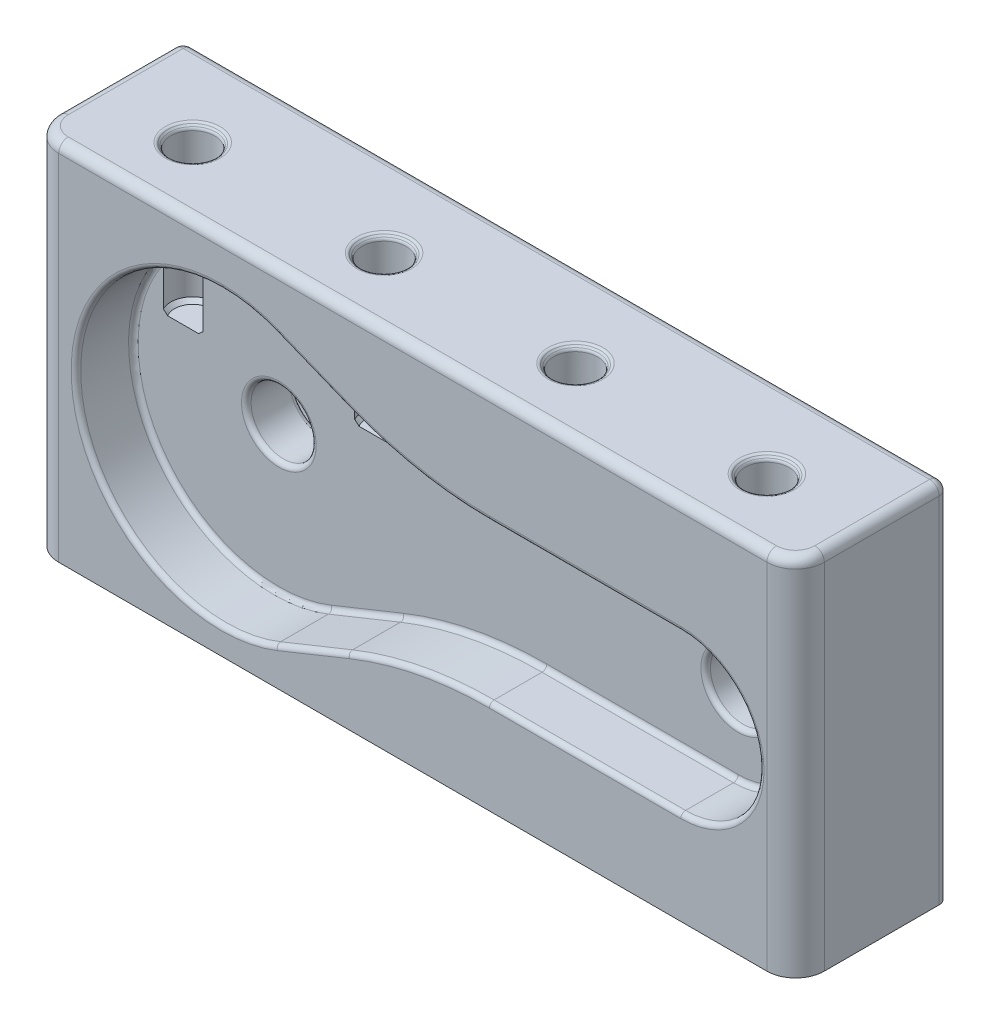
from build123d import *

# Parameters (mm, degrees)
SKETCH2_W           = 40
SKETCH2_H           = 19
BOSS_EXTRUDE1_DEPTH = 8
FILLET1_R           = 1.5
SKETCH5_R           = 1.15
CUT_EXTRUDE3_DEPTH  = 8
CHAMFER1_SIZE       = 0.2
FILLET3_R           = 0.2
FILLET2_R           = 0.5
SKETCH6_R           = 1.7
CUT_EXTRUDE4_DEPTH  = 24.542514734
SKETCH7_R           = 3
CUT_EXTRUDE5_DEPTH  = 2.5
CUT_EXTRUDE6_DEPTH  = 3
FILLET5_R           = 0.25
FILLET6_R           = 0.25


with BuildPart() as part:
    # Sketch2 → Boss-Extrude1 (new body)
    with BuildSketch(Plane.XY):
        Rectangle(SKETCH2_W, SKETCH2_H)
    extrude(amount=BOSS_EXTRUDE1_DEPTH)

    # Fillet1
    fillet1_edges = [part.edges().sort_by_distance(p)[0] for p in [
        (-20, 0, 8),
        (20, 0, 8),
    ]]
    fillet(fillet1_edges, radius=FILLET1_R)

    # Sketch5 → Cut-Extrude3 (cut)
    with BuildSketch(Plane(origin=(0, 9.5, 0), x_dir=(1, 0, 0), z_dir=(0, 1, 0))):
        with Locations(Location((-15, -4.5, 0), (0, 0, 270))):
            Circle(SKETCH5_R)
        with Locations(Location((-5, -4.5, 0), (0, 0, 270))):
            Circle(SKETCH5_R)
        with Locations(Location((5, -4.5, 0), (0, 0, 270))):
            Circle(SKETCH5_R)
        with Locations(Location((15, -4.5, 0), (0, 0, 270))):
            Circle(SKETCH5_R)
    extrude(amount=-CUT_EXTRUDE3_DEPTH, mode=Mode.SUBTRACT)

    # Chamfer1
    chamfer1_edges = [part.edges().sort_by_distance(p)[0] for p in [
        (-15, 1.5, 3.35),
        (-15, 9.5, 3.35),
        (-5, 1.5, 3.35),
        (-5, 9.5, 3.35),
        (5, 1.5, 3.35),
        (5, 9.5, 3.35),
        (15, 1.5, 3.35),
        (15, 9.5, 3.35),
    ]]
    chamfer(chamfer1_edges, length=CHAMFER1_SIZE)

    # Fillet3
    fillet3_edges = [part.edges().sort_by_distance(p)[0] for p in [
        (15, 9.3, 3.35),
        (-15, 9.5, 3.15),
        (-5, 9.5, 3.15),
        (5, 9.5, 3.15),
        (15, 9.5, 3.15),
        (5, 9.3, 3.35),
        (-5, 9.3, 3.35),
        (-15, 9.3, 3.35),
    ]]
    fillet(fillet3_edges, radius=FILLET3_R)

    # Fillet2
    fillet2_edges = [part.edges().sort_by_distance(p)[0] for p in [
        (0, 9.5, 8),
        (-20, 9.5, 3.25),
        (20, 9.5, 3.25),
        (-19.560660172, 9.5, 7.560660172),
        (19.560660172, 9.5, 7.560660172),
        (-20, 0, 0),
        (0, 9.5, 0),
        (20, 0, 0),
    ]]
    fillet(fillet2_edges, radius=FILLET2_R)

    # Sketch6 → Cut-Extrude4 (cut, through all)
    with BuildSketch(Plane.XY.offset(8)):
        with Locations((-10, -0.5)):
            Circle(SKETCH6_R)
        with Locations((14, -0.5)):
            Circle(SKETCH6_R)
    extrude(amount=-CUT_EXTRUDE4_DEPTH, mode=Mode.SUBTRACT)

    # Sketch7 → Cut-Extrude5 (cut)
    with BuildSketch(Plane(origin=(0, 0, 0), x_dir=(-1, 0, 0), z_dir=(0, 0, -1))):
        with Locations((-14, -0.5)):
            Circle(SKETCH7_R)
        with Locations((10, -0.5)):
            Circle(SKETCH7_R)
    extrude(amount=-CUT_EXTRUDE5_DEPTH, mode=Mode.SUBTRACT)

    # Sketch8 → Cut-Extrude6 (cut)
    with BuildSketch(Plane.XY.offset(8)):
        with BuildLine():
            Line((14, -4.6), (4, -4.6))
            ThreePointArc((4, -4.6), (0.232048588, -4.961827705), (-3.398190783, -6.034086651))
            Line((-3.398190783, -6.034086651), (-7.160290407, -7.549542498))
            ThreePointArc((-7.160290407, -7.549542498), (-17.6, -0.5), (-7.160290407, 6.549542498))
            Line((-7.160290407, 6.549542498), (-3.398190783, 5.034086651))
            ThreePointArc((-3.398190783, 5.034086651), (0.232048588, 3.961827705), (4, 3.6))
            Line((4, 3.6), (14, 3.6))
            ThreePointArc((14, 3.6), (18.1, -0.5), (14, -4.6))
        make_face()
    extrude(amount=-CUT_EXTRUDE6_DEPTH, mode=Mode.SUBTRACT)

    # Fillet5
    fillet5_edges = [part.edges().sort_by_distance(p)[0] for p in [
        (-6.597953083, 6.323020749, 5),
        (17.962434705, -1.553143488, 5),
        (9, -4.6, 5),
        (0.232048588, -4.961827705, 5),
        (-5.279240595, -6.791814574, 5),
        (-5.279240595, 5.791814574, 8),
        (0.232048588, 3.961827705, 8),
        (9, 3.6, 8),
        (18.1, -0.5, 8),
        (9, -4.6, 8),
        (0.232048588, -4.961827705, 8),
        (-5.279240595, -6.791814574, 8),
        (-7, -0.5, 0),
        (17, -0.5, 0),
        (-10.629406296, 7.073892507, 5),
        (-16.048947293, -5.101112544, 5),
        (-17.6, -0.5, 8),
    ]]
    fillet(fillet5_edges, radius=FILLET5_R)

    # Fillet6
    fillet6_edges = [part.edges().sort_by_distance(p)[0] for p in [
        (12.3, -0.5, 2.5),
        (-11.7, -0.5, 2.5),
        (12.3, -0.5, 5),
        (-11.7, -0.5, 5),
    ]]
    fillet(fillet6_edges, radius=FILLET6_R)


solid = part.part
